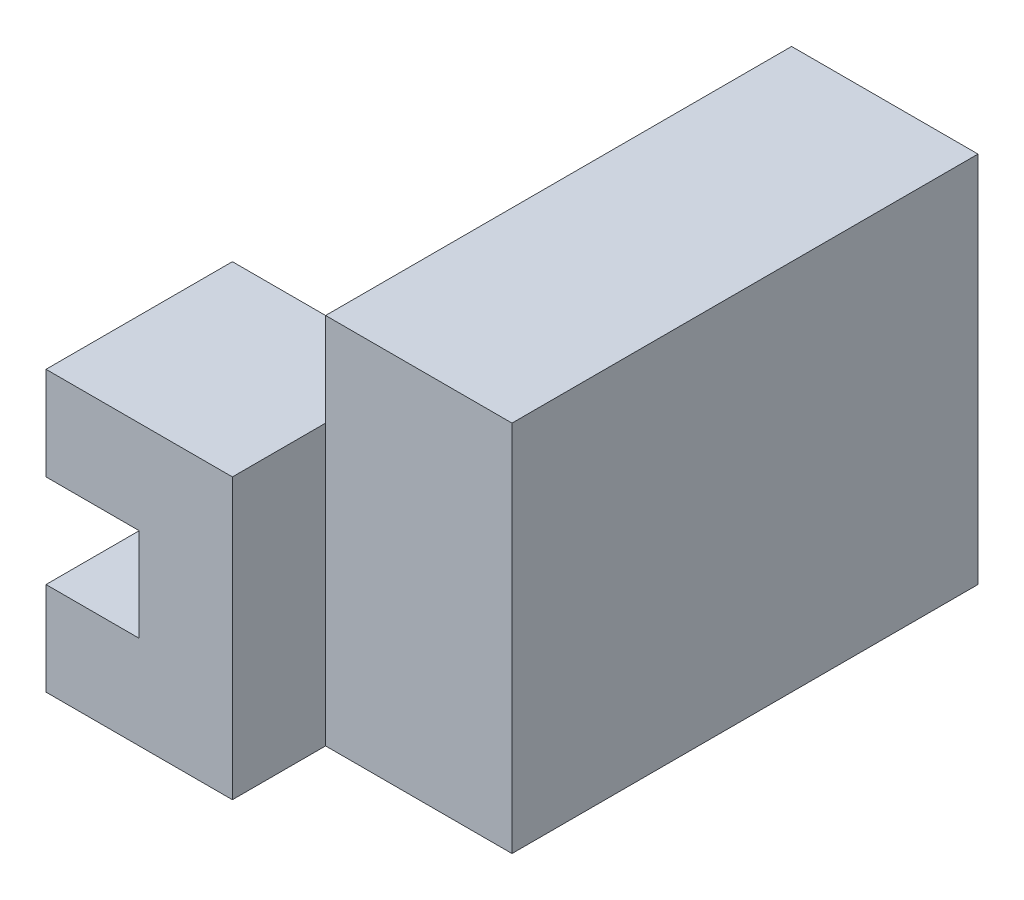
from build123d import *

# Parameters (mm, degrees)
SKETCH_1_W      = 2
SKETCH_1_H      = 4
EXTRUDE_1_DEPTH = 5
SKETCH_3_W      = 2
SKETCH_3_H      = 5
EXTRUDE_2_DEPTH = 1
EXTRUDE_3_DEPTH = 1


with BuildPart() as part:
    # 草圖1 → 填料-伸長1 (new body)
    with BuildSketch(Plane.XY):
        with Locations((1, 2)):
            Rectangle(SKETCH_1_W, SKETCH_1_H)
    extrude(amount=EXTRUDE_1_DEPTH)

    # 草圖3 → 填料-伸長2 (add)
    with BuildSketch(Plane.XZ):
        with Locations((-1, 2.5)):
            Rectangle(SKETCH_3_W, SKETCH_3_H)
    extrude(amount=-EXTRUDE_2_DEPTH)

    # 草圖4 → 填料-伸長3 (add, symmetric)
    with BuildSketch(Plane.XY.offset(5)):
        Polygon((-1, 1), (-1, 2), (-2, 2), (-2, 3), (0, 3), (0, 0), (-2, 0), (-2, 1), align=None)
    extrude(amount=EXTRUDE_3_DEPTH, both=True)


solid = part.part
